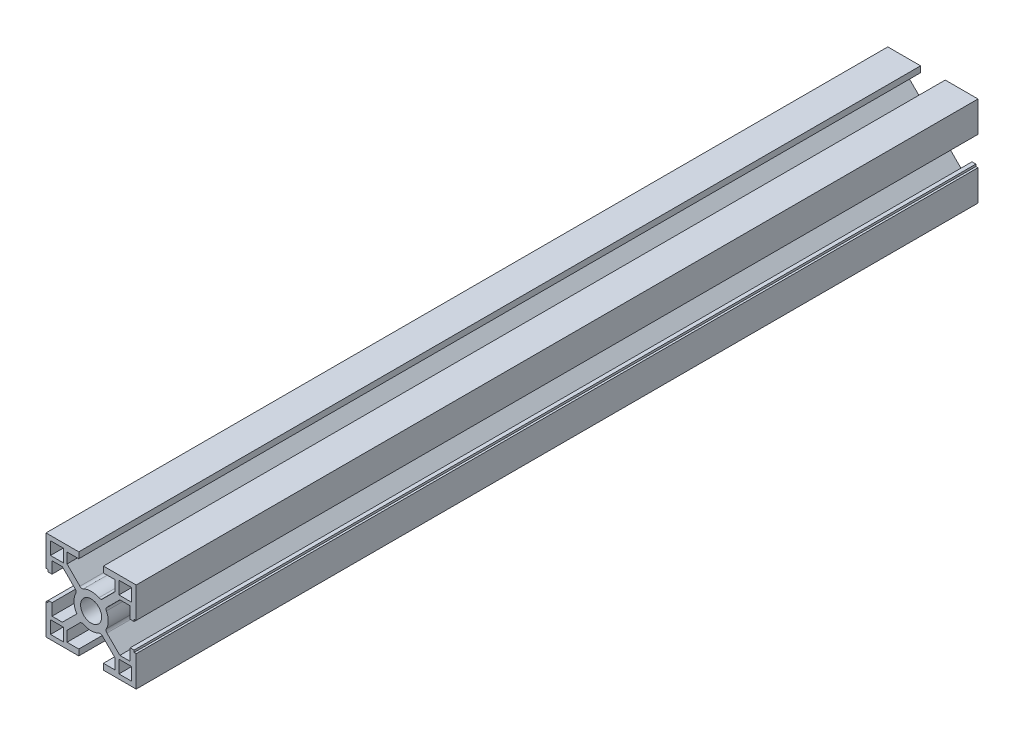
from build123d import *

# Parameters (mm, degrees)
SKETCH1_R           = 3.5
SKETCH1_W           = 4.25
SKETCH1_H           = 4.25
BOSS_EXTRUDE1_DEPTH = 140


with BuildPart() as part:
    # Sketch1 → Boss-Extrude1 (new, symmetric)
    with BuildSketch(Plane.XY):
        with BuildLine():
            Line((-13, 8), (-9.555634919, 8))
            Line((-9.555634919, 8), (-5.276706211, 3.721071292))
            ThreePointArc((-5.276706211, 3.721071292), (-4.996490762, 3.172693256), (-5.090706575, 2.564119062))
            ThreePointArc((-5.090706575, 2.564119062), (-5.688941006, -0.354894676), (-4.732561446, -3.176926527))
            Line((-4.732561446, -3.176926527), (-9.555634919, -8))
            Line((-9.555634919, -8), (-13, -8))
            Line((-13, -8), (-13, -4.1))
            Line((-13, -4.1), (-14.3, -4.1))
            Line((-14.3, -4.1), (-14.3, -4.8))
            Line((-14.3, -4.8), (-15, -4.8))
            Line((-15, -4.8), (-15, -15))
            Line((-15, -15), (-4.1, -15))
            Line((-4.1, -15), (-4.1, -13))
            Line((-4.1, -13), (-8, -13))
            Line((-8, -13), (-8, -9.555634919))
            Line((-8, -9.555634919), (-3.721071292, -5.276706211))
            ThreePointArc((-3.721071292, -5.276706211), (-3.172693256, -4.996490762), (-2.564119062, -5.090706575))
            ThreePointArc((-2.564119062, -5.090706575), (0, -5.7), (2.564119062, -5.090706575))
            ThreePointArc((2.564119062, -5.090706575), (3.172693256, -4.996490762), (3.721071292, -5.276706211))
            Line((3.721071292, -5.276706211), (8, -9.555634919))
            Line((8, -9.555634919), (8, -13))
            Line((8, -13), (4.1, -13))
            Line((4.1, -13), (4.1, -15))
            Line((4.1, -15), (15, -15))
            Line((15, -15), (15, -4.8))
            Line((15, -4.8), (14.3, -4.8))
            Line((14.3, -4.8), (14.3, -4.1))
            Line((14.3, -4.1), (13, -4.1))
            Line((13, -4.1), (13, -8))
            Line((13, -8), (9.555634919, -8))
            Line((9.555634919, -8), (5.276706211, -3.721071292))
            ThreePointArc((5.276706211, -3.721071292), (4.996490762, -3.172693256), (5.090706575, -2.564119062))
            ThreePointArc((5.090706575, -2.564119062), (5.7, 0), (5.090706575, 2.564119062))
            ThreePointArc((5.090706575, 2.564119062), (4.996490762, 3.172693256), (5.276706211, 3.721071292))
            Line((5.276706211, 3.721071292), (9.555634919, 8))
            Line((9.555634919, 8), (13, 8))
            Line((13, 8), (13, 4.1))
            Line((13, 4.1), (14.3, 4.1))
            Line((14.3, 4.1), (14.3, 4.8))
            Line((14.3, 4.8), (15, 4.8))
            Line((15, 4.8), (15, 15))
            Line((15, 15), (4.1, 15))
            Line((4.1, 15), (4.1, 13))
            Line((4.1, 13), (8, 13))
            Line((8, 13), (8, 9.555634919))
            Line((8, 9.555634919), (3.721071292, 5.276706211))
            ThreePointArc((3.721071292, 5.276706211), (3.172693256, 4.996490762), (2.564119062, 5.090706575))
            ThreePointArc((2.564119062, 5.090706575), (0, 5.7), (-2.564119062, 5.090706575))
            ThreePointArc((-2.564119062, 5.090706575), (-3.172693256, 4.996490762), (-3.721071292, 5.276706211))
            Line((-3.721071292, 5.276706211), (-8, 9.555634919))
            Line((-8, 9.555634919), (-8, 13))
            Line((-8, 13), (-4.1, 13))
            Line((-4.1, 13), (-4.1, 15))
            Line((-4.1, 15), (-15, 15))
            Line((-15, 15), (-15, 4.8))
            Line((-15, 4.8), (-14.3, 4.8))
            Line((-14.3, 4.8), (-14.3, 4.1))
            Line((-14.3, 4.1), (-13, 4.1))
            Line((-13, 4.1), (-13, 8))
        make_face()
        Circle(SKETCH1_R, mode=Mode.SUBTRACT)
        with Locations((11.375, 11.375)):
            Rectangle(SKETCH1_W, SKETCH1_H, mode=Mode.SUBTRACT)
        with Locations((-11.375, -11.375)):
            Rectangle(SKETCH1_W, SKETCH1_H, mode=Mode.SUBTRACT)
        with Locations((11.375, -11.375)):
            Rectangle(SKETCH1_W, SKETCH1_H, mode=Mode.SUBTRACT)
        with Locations((-11.375, 11.375)):
            Rectangle(SKETCH1_W, SKETCH1_H, mode=Mode.SUBTRACT)
    extrude(amount=BOSS_EXTRUDE1_DEPTH, both=True)


solid = part.part
